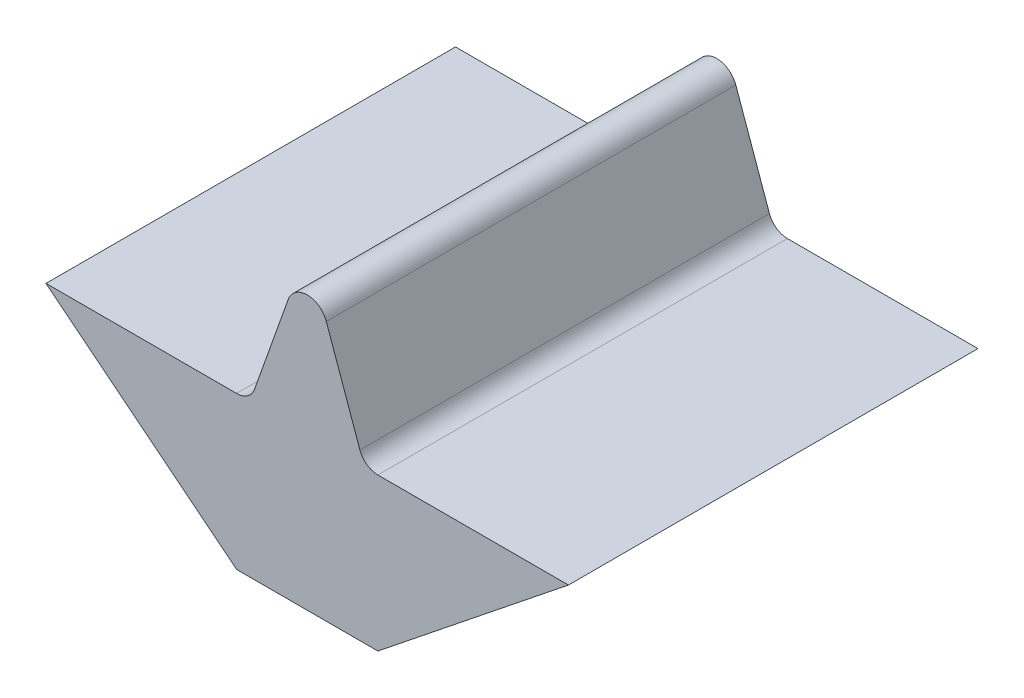
from build123d import *

# Parameters (mm, degrees)
BOSS_EXTRUDE1_DEPTH = 107.424


with BuildPart() as part:
    # Sketch2 → Boss-Extrude1 (new body)
    with BuildSketch(Plane.XY):
        with BuildLine():
            Line((-269.284845729, 142.112072029), (-219.284845729, 142.112072029))
            ThreePointArc((-219.284845729, 142.112072029), (-216.401959188, 143.026859037), (-214.573963508, 145.436485952))
            Line((-214.573963508, 145.436485952), (-205.756404805, 170.226904714))
            ThreePointArc((-205.756404805, 170.226904714), (-200.756404805, 173.755345637), (-195.756404805, 170.226904714))
            Line((-195.756404805, 170.226904714), (-186.938846102, 145.436485952))
            ThreePointArc((-186.938846102, 145.436485952), (-185.110850422, 143.026859037), (-182.227963882, 142.112072029))
            Line((-182.227963882, 142.112072029), (-132.227963882, 142.112072029))
            Line((-132.227963882, 142.112072029), (-182.227963882, 102.112072029))
            Line((-182.227963882, 102.112072029), (-219.284845729, 102.112072029))
            Line((-219.284845729, 102.112072029), (-269.284845729, 142.112072029))
        make_face()
    extrude(amount=BOSS_EXTRUDE1_DEPTH)


solid = part.part
